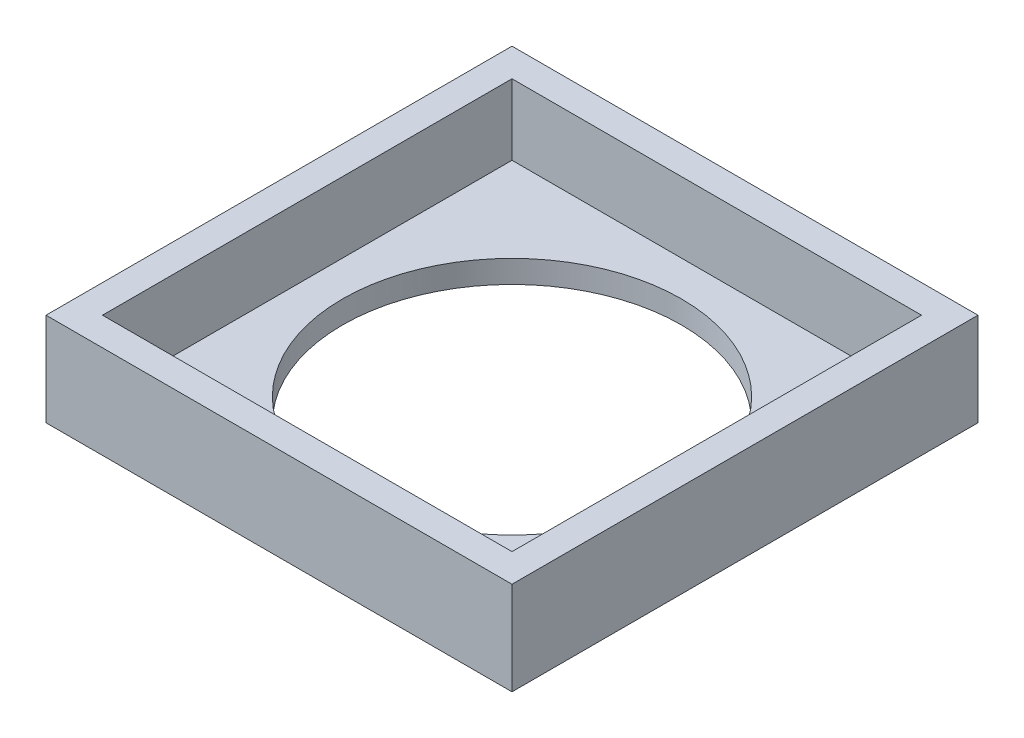
from build123d import *

# Parameters (mm, degrees)
CROQUIS1_W              = 33
CROQUIS1_H              = 33
SALIENTE_EXTRUIR1_DEPTH = 6.6
CROQUIS2_W              = 29
CROQUIS2_H              = 29
CORTAR_EXTRUIR1_DEPTH   = 5
CROQUIS3_R              = 12
CORTAR_EXTRUIR2_DEPTH   = 5


with BuildPart() as part:
    # Croquis1 → Saliente-Extruir1 (new body)
    with BuildSketch(Plane(origin=(0, 0, 0), x_dir=(1, 0, 0), z_dir=(0, 1, 0))):
        Rectangle(CROQUIS1_W, CROQUIS1_H)
    extrude(amount=SALIENTE_EXTRUIR1_DEPTH)

    # Croquis2 → Cortar-Extruir1 (cut)
    with BuildSketch(Plane(origin=(0, 6.6, 0), x_dir=(1, 0, 0), z_dir=(0, 1, 0))):
        Rectangle(CROQUIS2_W, CROQUIS2_H)
    extrude(amount=-CORTAR_EXTRUIR1_DEPTH, mode=Mode.SUBTRACT)

    # Croquis3 → Cortar-Extruir2 (cut)
    with BuildSketch(Plane(origin=(0, 1.6, 0), x_dir=(1, 0, 0), z_dir=(0, 1, 0))):
        with Locations(Location((0, 0, 0), (0, 0, 270))):
            Circle(CROQUIS3_R)
    extrude(amount=-CORTAR_EXTRUIR2_DEPTH, mode=Mode.SUBTRACT)


solid = part.part
